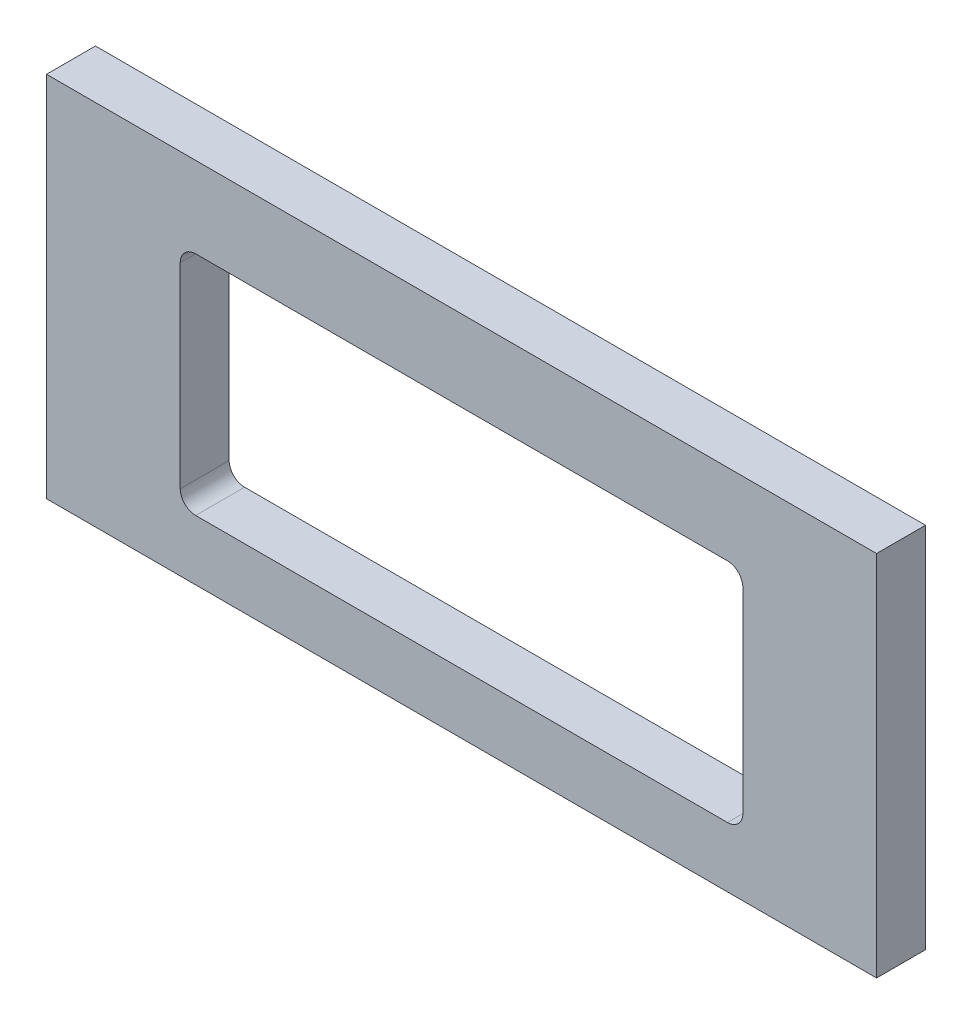
from build123d import *

# Parameters (mm, degrees)
SKETCH1_W           = 107.7
SKETCH1_H           = 47.7
BOSS_EXTRUDE1_DEPTH = 6.35


with BuildPart() as part:
    # Sketch1 → Boss-Extrude1 (new body)
    with BuildSketch(Plane.XY):
        with Locations((0, 23.85)):
            Rectangle(SKETCH1_W, SKETCH1_H)
        with BuildLine():
            Line((34.500012, 7.8), (-34.499988, 7.8))
            ThreePointArc((-34.499988, 7.8), (-35.914201562, 8.385786438), (-36.499988, 9.8))
            Line((-36.499988, 9.8), (-36.499988, 35.2))
            ThreePointArc((-36.499988, 35.2), (-35.914201562, 36.614213562), (-34.499988, 37.2))
            Line((-34.499988, 37.2), (34.500012, 37.2))
            ThreePointArc((34.500012, 37.2), (35.914225562, 36.614213562), (36.500012, 35.2))
            Line((36.500012, 35.2), (36.500012, 9.8))
            ThreePointArc((36.500012, 9.8), (35.914225562, 8.385786438), (34.500012, 7.8))
        make_face(mode=Mode.SUBTRACT)
    extrude(amount=BOSS_EXTRUDE1_DEPTH)


solid = part.part
